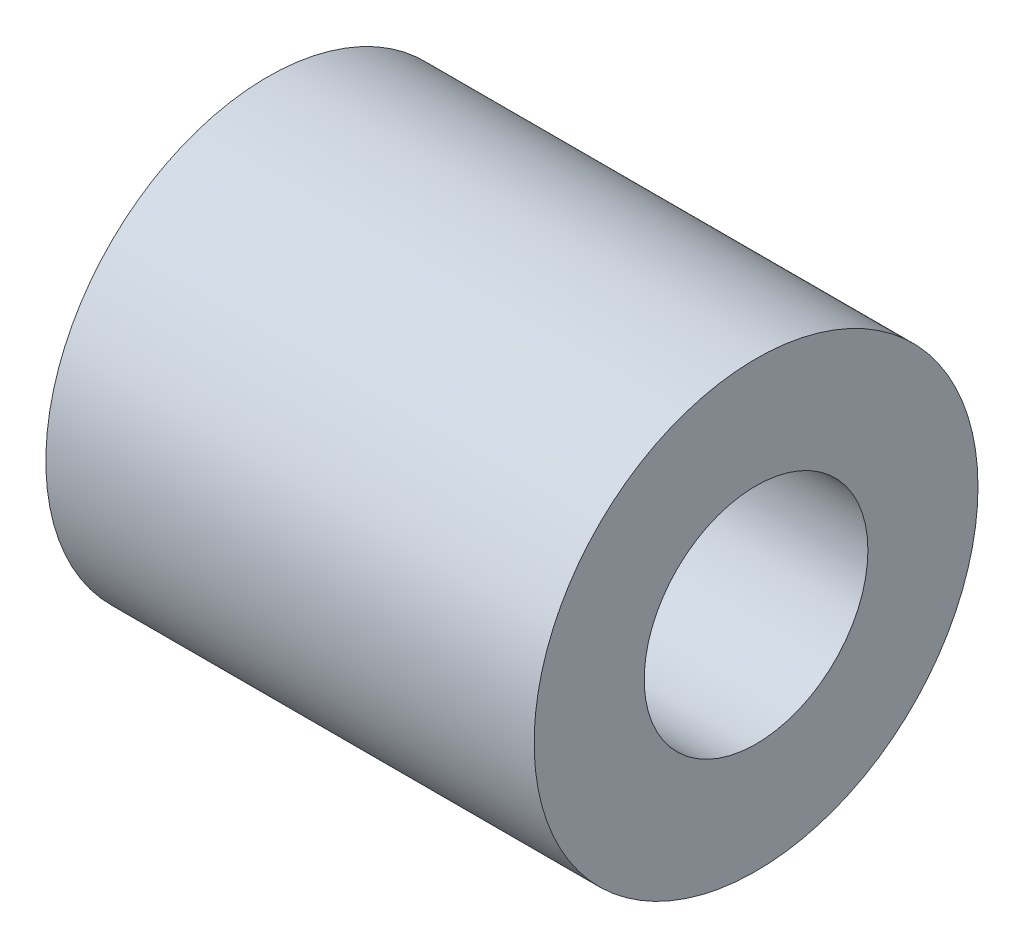
from build123d import *

# Parameters (mm, degrees)
SKETCH1_W = 13.97
SKETCH1_H = 3.1496


with BuildPart() as part:
    # Sketch1 → Revolve1 (revolve)
    with BuildSketch(Plane.XY, mode=Mode.PRIVATE) as revolve1_sk:
        with Locations((-6.985, 4.7752)):
            Rectangle(SKETCH1_W, SKETCH1_H)
    revolve(revolve1_sk.sketch.rotate(Axis((0, 0, 0), (-1, 0, 0)), 90), axis=Axis((0, 0, 0), (-1, 0, 0)))


solid = part.part
